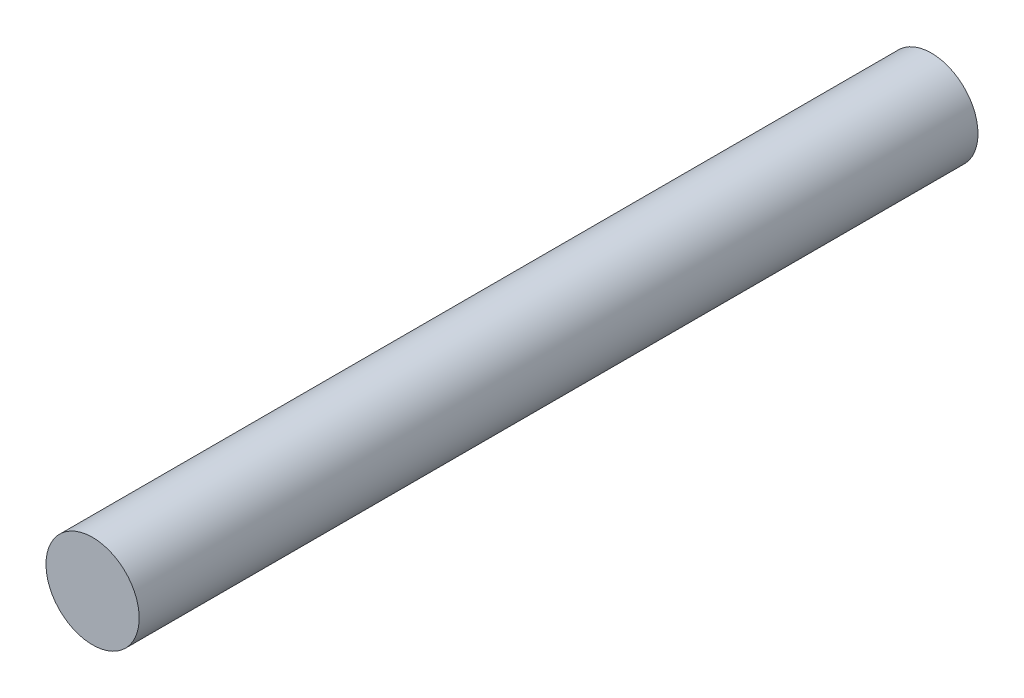
from build123d import *

# Parameters (mm, degrees)
SKETCH_1_R      = 5
EXTRUDE_1_DEPTH = 90


with BuildPart() as part:
    # 草图1 → 凸台-拉伸1 (new body)
    with BuildSketch(Plane.XY):
        with Locations(Location((0, 0, 0), (0, 0, 90))):
            Circle(SKETCH_1_R)
    extrude(amount=EXTRUDE_1_DEPTH)


solid = part.part
